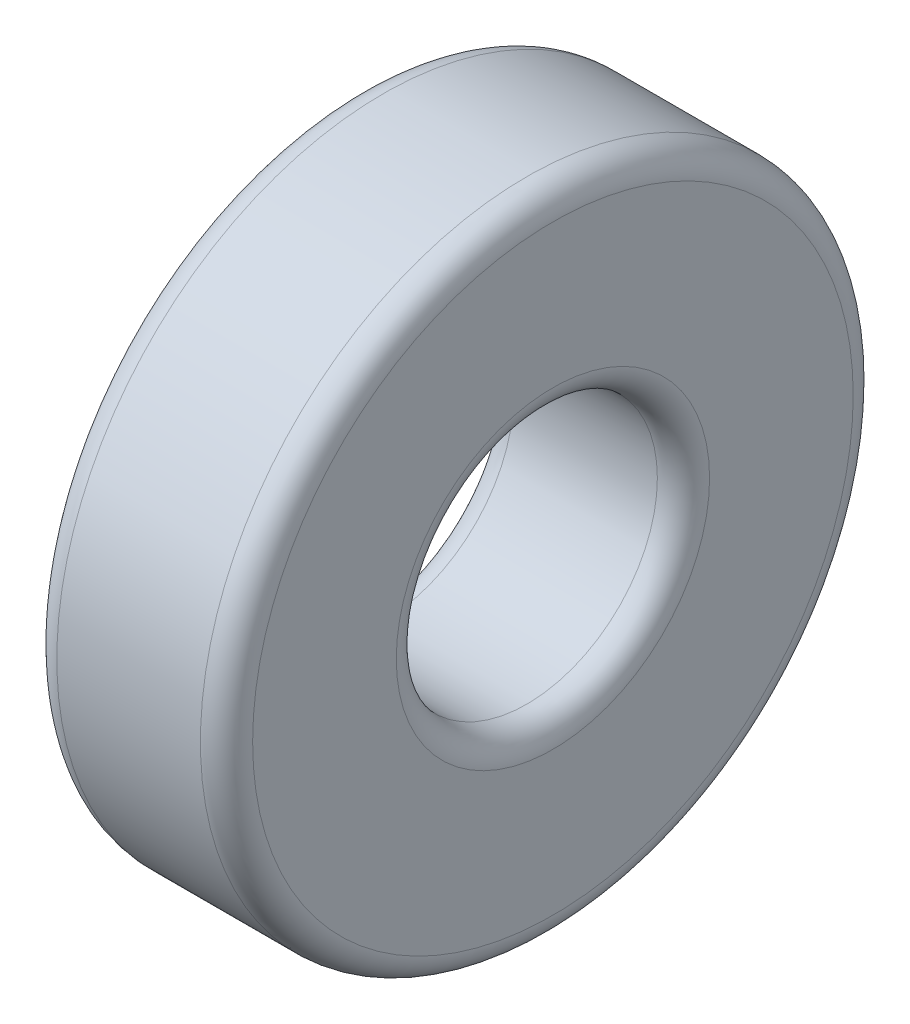
from build123d import *


with BuildPart() as part:
    # Sketch1 → Revolve1 (revolve)
    with BuildSketch(Plane(origin=(0, 0, 0), x_dir=(-1, 0, 0), z_dir=(0, 1, 0)), mode=Mode.PRIVATE) as revolve1_sk:
        with BuildLine():
            Line((2.75, 12.5), (-2.75, 12.5))
            ThreePointArc((-2.75, 12.5), (-3.457106781, 12.207106781), (-3.75, 11.5))
            Line((-3.75, 11.5), (-3.75, 6))
            ThreePointArc((-3.75, 6), (-3.457106781, 5.292893219), (-2.75, 5))
            Line((-2.75, 5), (2.75, 5))
            ThreePointArc((2.75, 5), (3.457106781, 5.292893219), (3.75, 6))
            Line((3.75, 6), (3.75, 11.5))
            ThreePointArc((3.75, 11.5), (3.457106781, 12.207106781), (2.75, 12.5))
        make_face()
    revolve(revolve1_sk.sketch.rotate(Axis((-3.111111111, 0, 0), (-1, 0, 0)), 180), axis=Axis((-3.111111111, 0, 0), (-1, 0, 0)))


solid = part.part
